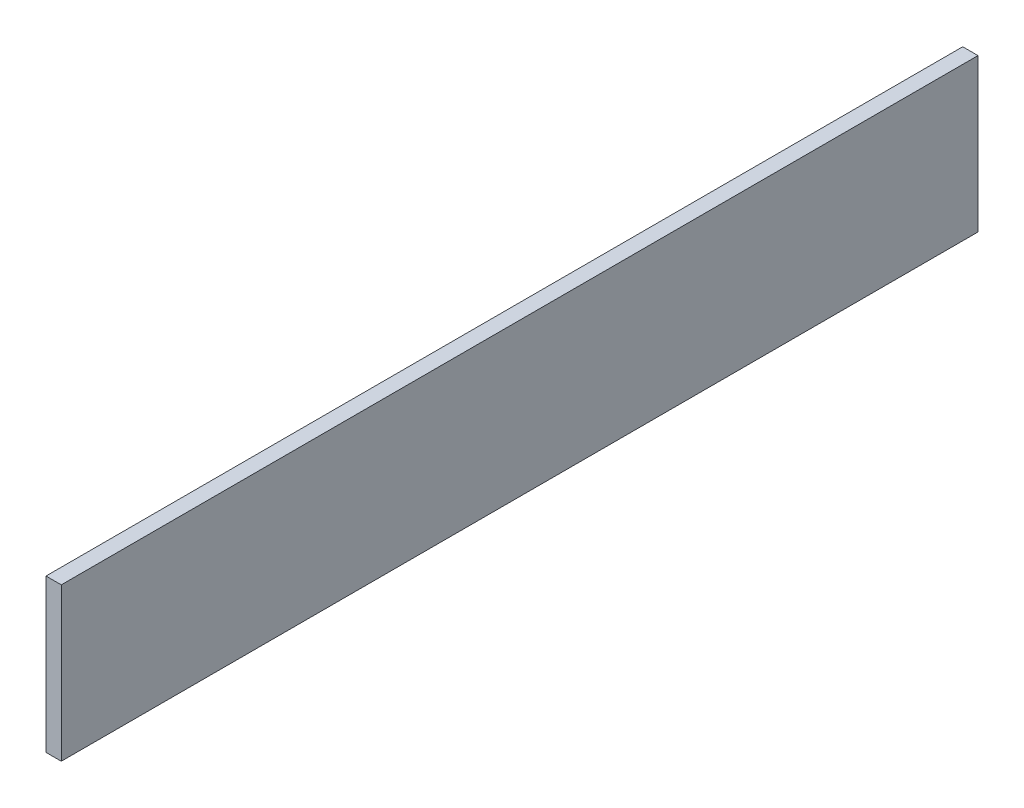
from build123d import *

# Parameters (mm, degrees)
SKETCH1_W           = 1
SKETCH1_H           = 60
BOSS_EXTRUDE1_DEPTH = 10


with BuildPart() as part:
    # Sketch1 → Boss-Extrude1 (new body)
    with BuildSketch(Plane(origin=(0, 0, 0), x_dir=(1, 0, 0), z_dir=(0, 1, 0))):
        with Locations((0.5, 30)):
            Rectangle(SKETCH1_W, SKETCH1_H)
    extrude(amount=BOSS_EXTRUDE1_DEPTH)


solid = part.part
